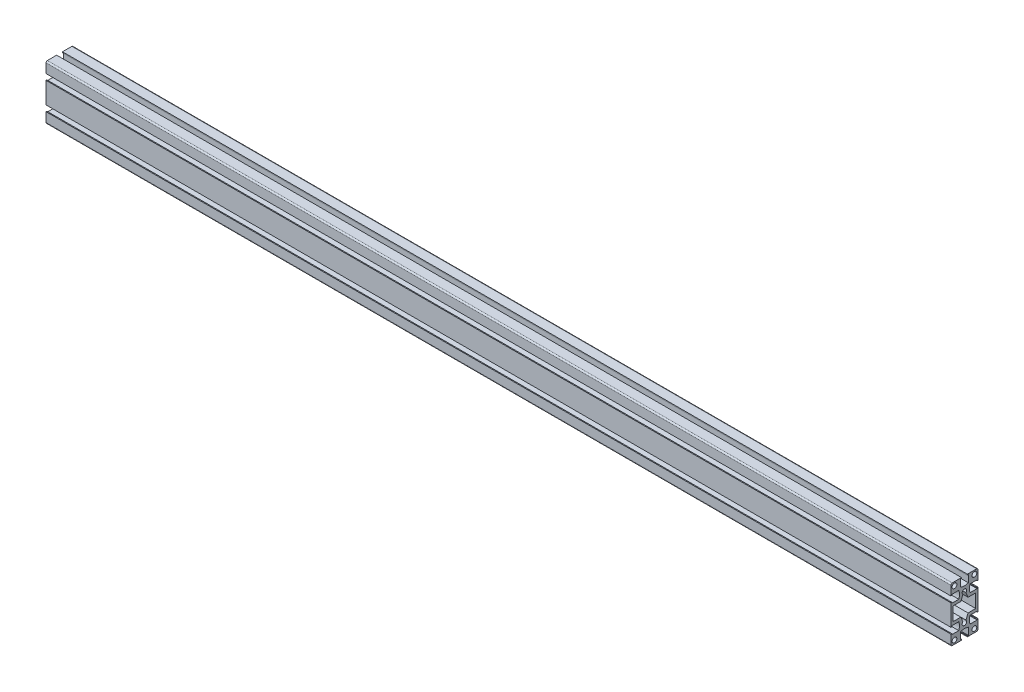
from build123d import *

# Parameters (mm, degrees)
SKETCH12_R                = 2.65
F_30_X_60G_X_R1_5_1_DEPTH = 1000


with BuildPart() as part:
    # Sketch12 → 工业铝型材 30 X 60G X R1.5(1) (new body)
    with BuildSketch(Plane(origin=(0, 0, 0), x_dir=(0, 0, -1), z_dir=(1, 0, 0))):
        with BuildLine():
            Line((-3.25, 30), (-3.25, 29))
            Line((-3.25, 29), (-4.25, 29))
            Line((-4.25, 29), (-4.25, 21.277812156))
            ThreePointArc((-4.25, 21.277812156), (0, 20.5), (4.25, 21.277812156))
            Line((4.25, 21.277812156), (4.25, 29))
            Line((4.25, 29), (3.25, 29))
            Line((3.25, 29), (3.25, 30))
            Line((3.25, 30), (13.5, 30))
            ThreePointArc((13.5, 30), (14.560660172, 29.560660172), (15, 28.5))
            Line((15, 28.5), (15, 18.25))
            Line((15, 18.25), (14, 18.25))
            Line((14, 18.25), (14, 19.25))
            Line((14, 19.25), (6.277812156, 19.25))
            ThreePointArc((6.277812156, 19.25), (5.5, 15), (6.277812156, 10.75))
            Line((6.277812156, 10.75), (14, 10.75))
            Line((14, 10.75), (14, 11.75))
            Line((14, 11.75), (15, 11.75))
            Line((15, 11.75), (15, -11.75))
            Line((15, -11.75), (14, -11.75))
            Line((14, -11.75), (14, -10.75))
            Line((14, -10.75), (6.277812156, -10.75))
            ThreePointArc((6.277812156, -10.75), (5.5, -15), (6.277812156, -19.25))
            Line((6.277812156, -19.25), (14, -19.25))
            Line((14, -19.25), (14, -18.25))
            Line((14, -18.25), (15, -18.25))
            Line((15, -18.25), (15, -28.5))
            ThreePointArc((15, -28.5), (14.560660172, -29.560660172), (13.5, -30))
            Line((13.5, -30), (3.25, -30))
            Line((3.25, -30), (3.25, -29))
            Line((3.25, -29), (4.25, -29))
            Line((4.25, -29), (4.25, -21.277812156))
            ThreePointArc((4.25, -21.277812156), (0, -20.5), (-4.25, -21.277812156))
            Line((-4.25, -21.277812156), (-4.25, -29))
            Line((-4.25, -29), (-3.25, -29))
            Line((-3.25, -29), (-3.25, -30))
            Line((-3.25, -30), (-13.5, -30))
            ThreePointArc((-13.5, -30), (-14.560660172, -29.560660172), (-15, -28.5))
            Line((-15, -28.5), (-15, -18.25))
            Line((-15, -18.25), (-14, -18.25))
            Line((-14, -18.25), (-14, -19.25))
            Line((-14, -19.25), (-6.277812156, -19.25))
            ThreePointArc((-6.277812156, -19.25), (-5.5, -15), (-6.277812156, -10.75))
            Line((-6.277812156, -10.75), (-14, -10.75))
            Line((-14, -10.75), (-14, -11.75))
            Line((-14, -11.75), (-15, -11.75))
            Line((-15, -11.75), (-15, 11.75))
            Line((-15, 11.75), (-14, 11.75))
            Line((-14, 11.75), (-14, 10.75))
            Line((-14, 10.75), (-6.277812156, 10.75))
            ThreePointArc((-6.277812156, 10.75), (-5.5, 15), (-6.277812156, 19.25))
            Line((-6.277812156, 19.25), (-14, 19.25))
            Line((-14, 19.25), (-14, 18.25))
            Line((-14, 18.25), (-15, 18.25))
            Line((-15, 18.25), (-15, 28.5))
            ThreePointArc((-15, 28.5), (-14.560660172, 29.560660172), (-13.5, 30))
            Line((-13.5, 30), (-3.25, 30))
        make_face()
        with Locations((-11, 26)):
            Circle(SKETCH12_R, mode=Mode.SUBTRACT)
        with Locations((11, 26)):
            Circle(SKETCH12_R, mode=Mode.SUBTRACT)
        with Locations((11, -26)):
            Circle(SKETCH12_R, mode=Mode.SUBTRACT)
        with Locations((-11, -26)):
            Circle(SKETCH12_R, mode=Mode.SUBTRACT)
        with BuildLine():
            Line((-12.5, 7.5), (-4, 7.5))
            Line((-4, 7.5), (-1.665625283, 13.135679101))
            ThreePointArc((-1.665625283, 13.135679101), (0, 17.5), (1.665625283, 13.135679101))
            Line((1.665625283, 13.135679101), (4, 7.5))
            Line((4, 7.5), (12.5, 7.5))
            Line((12.5, 7.5), (12.5, -7.5))
            Line((12.5, -7.5), (4, -7.5))
            Line((4, -7.5), (1.665625283, -13.135679101))
            ThreePointArc((1.665625283, -13.135679101), (0, -17.5), (-1.665625283, -13.135679101))
            Line((-1.665625283, -13.135679101), (-4, -7.5))
            Line((-4, -7.5), (-12.5, -7.5))
            Line((-12.5, -7.5), (-12.5, 7.5))
        make_face(mode=Mode.SUBTRACT)
    extrude(amount=F_30_X_60G_X_R1_5_1_DEPTH)


solid = part.part
